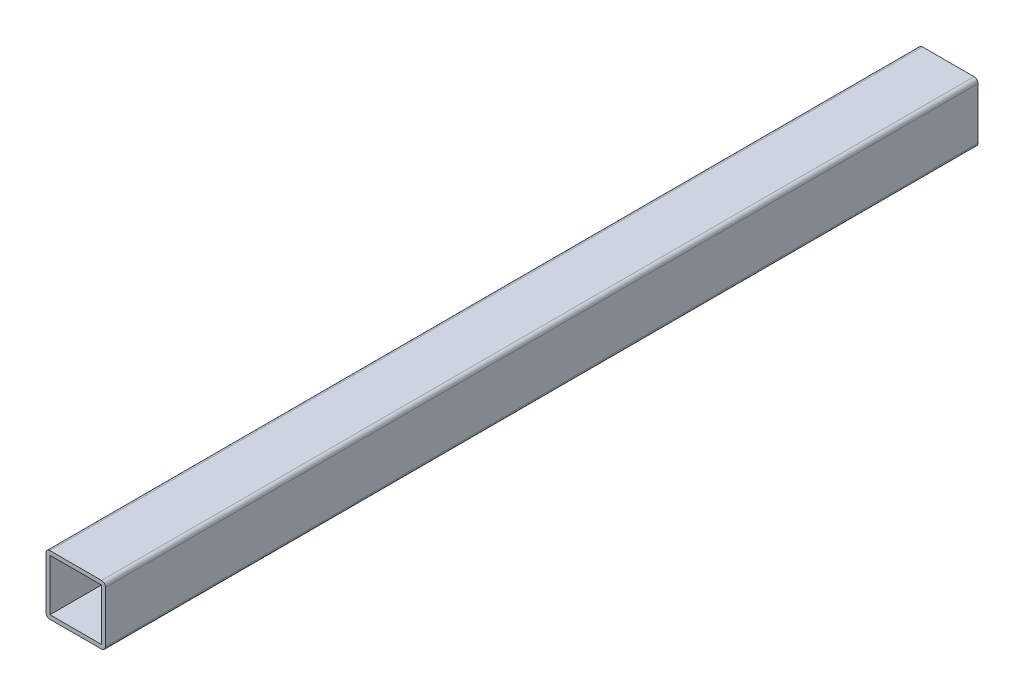
from build123d import *

# Parameters (mm, degrees)
Y_KSEKLIK_EKSTR_ZYON1_DEPTH      = 220
Y_KSEKLIK_EKSTR_ZYON1_DEPTH_BACK = 220
IZIM1_W                          = 26
IZIM1_H                          = 26


with BuildPart() as part:
    # Çizim1 → Yükseklik-Ekstrüzyon1 (new, two sides: drawn at the far end of the back side and taken through both)
    with BuildSketch(Plane.XY.offset(-Y_KSEKLIK_EKSTR_ZYON1_DEPTH_BACK)):
        with BuildLine():
            Line((-13, 15), (13, 15))
            ThreePointArc((13, 15), (14.414213562, 14.414213562), (15, 13))
            Line((15, 13), (15, -13))
            ThreePointArc((15, -13), (14.414213562, -14.414213562), (13, -15))
            Line((13, -15), (-13, -15))
            ThreePointArc((-13, -15), (-14.414213562, -14.414213562), (-15, -13))
            Line((-15, -13), (-15, 13))
            ThreePointArc((-15, 13), (-14.414213562, 14.414213562), (-13, 15))
        make_face()
        Rectangle(IZIM1_W, IZIM1_H, mode=Mode.SUBTRACT)
    extrude(amount=Y_KSEKLIK_EKSTR_ZYON1_DEPTH + Y_KSEKLIK_EKSTR_ZYON1_DEPTH_BACK)


solid = part.part
